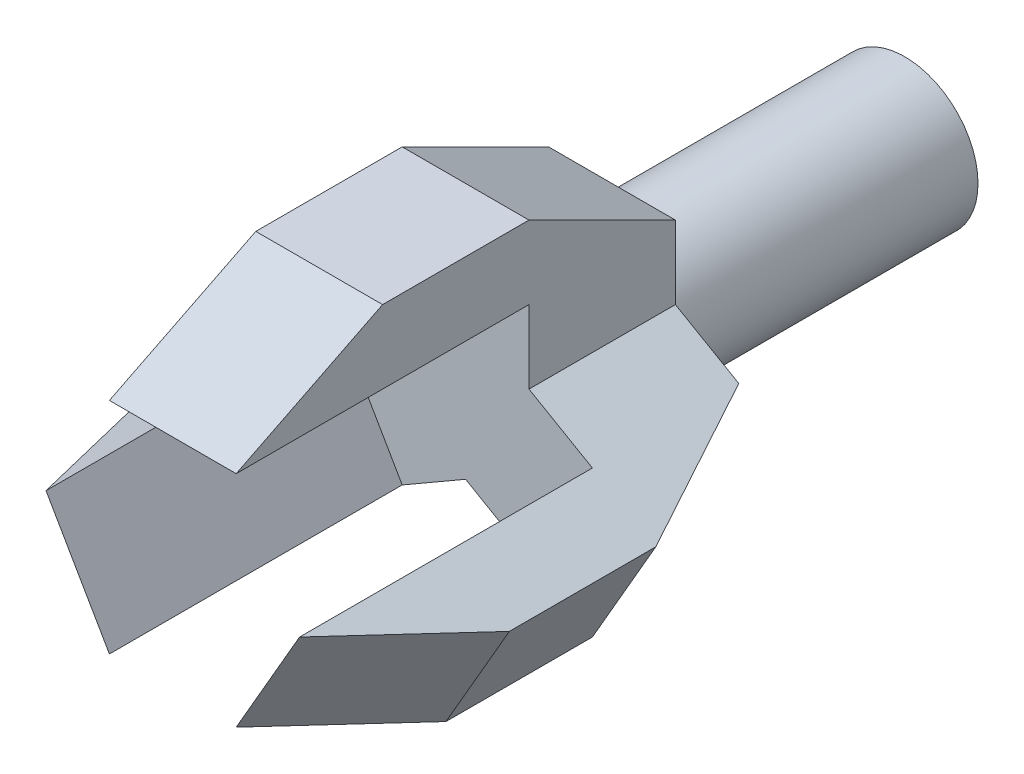
from build123d import *

# Parameters (mm, degrees)
SKETCH1_R           = 50
BOSS_EXTRUDE1_DEPTH = 200
BOSS_EXTRUDE2_DEPTH = 100
BOSS_EXTRUDE4_DEPTH = 86.602540378
CIRPATTERN1_COUNT   = 3


with BuildPart() as part:
    # Sketch1 → Boss-Extrude1 (new body)
    with BuildSketch(Plane.XY):
        Circle(SKETCH1_R)
    extrude(amount=BOSS_EXTRUDE1_DEPTH)

    # Sketch2 → Boss-Extrude2 (add)
    with BuildSketch(Plane.XY.offset(200)):
        Polygon((43.301270189, 25), (43.301270189, 75), (-43.301270189, 75), (-43.301270189, 25), (0, 0), align=None)
    boss_extrude2 = extrude(amount=BOSS_EXTRUDE2_DEPTH)

    # Sketch3 → Boss-Extrude4 (add)
    with BuildSketch(Plane(origin=(-43.301270189, 0, 0), x_dir=(0, 1, 0), z_dir=(-1, 0, 0))):
        Polygon((75, -200), (75, -500), (125, -400), (125, -300), align=None)
    boss_extrude4 = extrude(amount=-BOSS_EXTRUDE4_DEPTH)

    # CirPattern1: Boss-Extrude2, Boss-Extrude4 ×3 about axis
    cirpattern1_axis = Axis((0, 0, 0), (0, 0, 1))
    add([boss_extrude2.rotate(cirpattern1_axis, i * 360 / CIRPATTERN1_COUNT) for i in range(1, CIRPATTERN1_COUNT)])
    add([boss_extrude4.rotate(cirpattern1_axis, i * 360 / CIRPATTERN1_COUNT) for i in range(1, CIRPATTERN1_COUNT)])


solid = part.part
